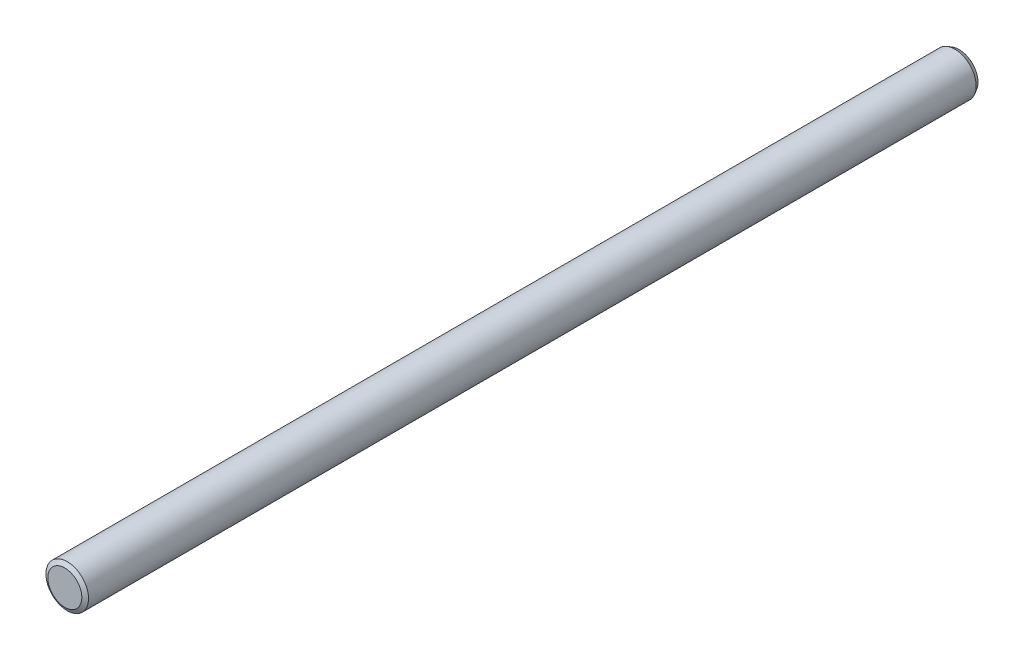
from build123d import *
from OCP.BRepFilletAPI import BRepFilletAPI_MakeChamfer

# Parameters (mm, degrees)
ESBO_O1_R                = 0.25
RESSALTO_EXTRUS_O1_DEPTH = 10.5
CHANFRO1_SIZE            = 0.05
CHANFRO1_SIZE2           = 0.028867513


with BuildPart() as part:
    # Esboço1 → Ressalto-extrusão1 (new body)
    with BuildSketch(Plane.XY):
        with Locations((0.25, 20.509140677)):
            Circle(ESBO_O1_R)
    extrude(amount=RESSALTO_EXTRUS_O1_DEPTH)

    # Chanfro1: one chamfer whose edges measure the first distance from different faces: ONE call of the kernel's chamfer builder (chamfer() names one face for all edges)
    chanfro1_edges_1 = [part.edges().sort_by_distance(p)[0] for p in [
        (0, 20.509140677, 0),
    ]]
    chanfro1_side_1 = [part.faces().sort_by_distance(p)[0] for p in [
        (0, 20.509140677, 5.25),
    ]]
    chanfro1_edges_2 = [part.edges().sort_by_distance(p)[0] for p in [
        (0, 20.509140677, 10.5),
    ]]
    chanfro1_side_2 = [part.faces().sort_by_distance(p)[0] for p in [
        (0.25, 20.509140677, 10.5),
    ]]
    chanfro1 = BRepFilletAPI_MakeChamfer(part.part.solid().wrapped)
    for e in chanfro1_edges_1:
        chanfro1.Add(CHANFRO1_SIZE, CHANFRO1_SIZE2, e.wrapped, chanfro1_side_1[0].wrapped)  # the first distance lies on this face
    for e in chanfro1_edges_2:
        chanfro1.Add(CHANFRO1_SIZE, CHANFRO1_SIZE2, e.wrapped, chanfro1_side_2[0].wrapped)  # the first distance lies on this face
    add(Compound.cast(chanfro1.Shape()), mode=Mode.REPLACE)


solid = part.part
